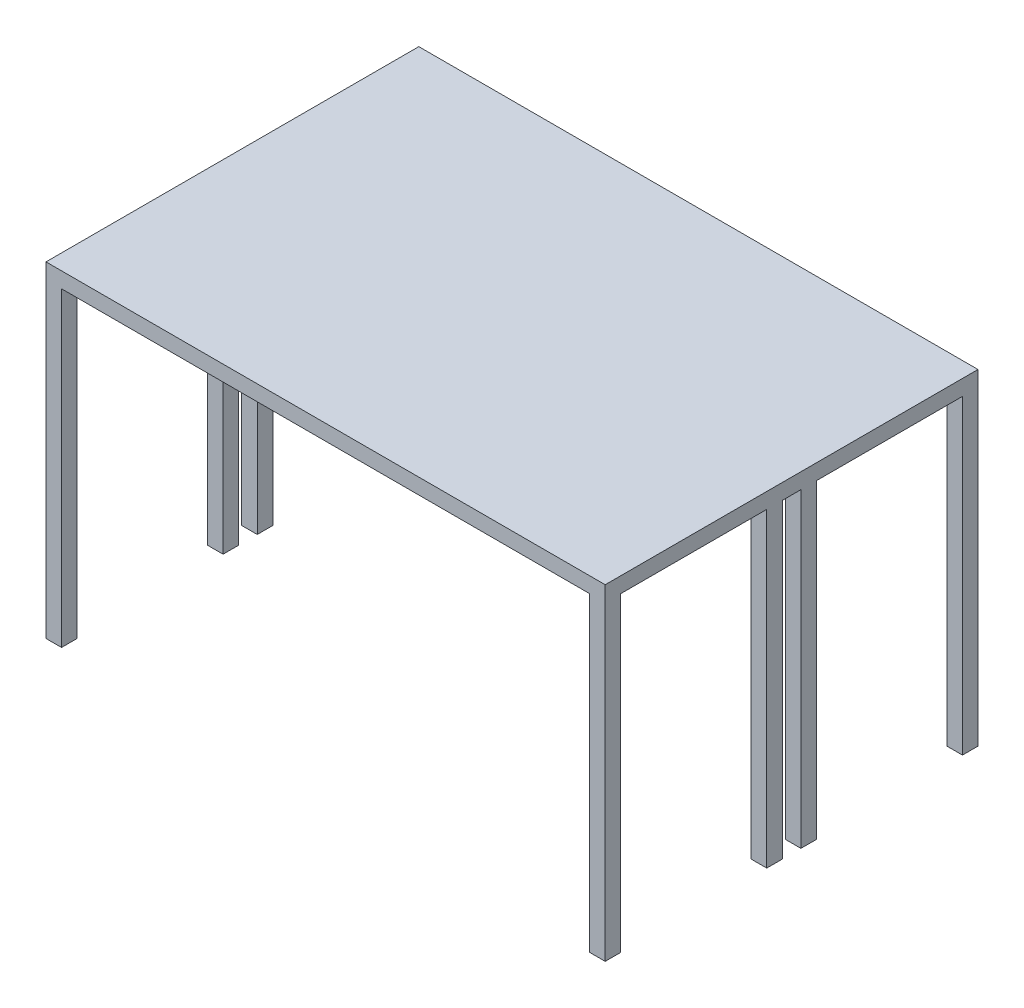
from build123d import *

# Parameters (mm, degrees)
SKETCH1_W           = 1800
SKETCH1_H           = 1200
BOSS_EXTRUDE1_DEPTH = 50
SKETCH2_W           = 50
SKETCH2_H           = 50
BOSS_EXTRUDE2_DEPTH = 1000


with BuildPart() as part:
    # Sketch1 → Boss-Extrude1 (new body)
    with BuildSketch(Plane(origin=(0, 0, 0), x_dir=(1, 0, 0), z_dir=(0, 1, 0))):
        Rectangle(SKETCH1_W, SKETCH1_H)
    extrude(amount=BOSS_EXTRUDE1_DEPTH)

    # Sketch2 → Boss-Extrude2 (add)
    with BuildSketch(Plane.XZ):
        with Locations((875, -575)):
            Rectangle(SKETCH2_W, SKETCH2_H)
        with Locations((-875, -575)):
            Rectangle(SKETCH2_W, SKETCH2_H)
        with Locations((-875, 575)):
            Rectangle(SKETCH2_W, SKETCH2_H)
        with Locations((875, 575)):
            Rectangle(SKETCH2_W, SKETCH2_H)
        with Locations((-875, 55)):
            Rectangle(SKETCH2_W, SKETCH2_H)
        with Locations((-875, -55)):
            Rectangle(SKETCH2_W, SKETCH2_H)
        with Locations((875, -55)):
            Rectangle(SKETCH2_W, SKETCH2_H)
        with Locations((875, 55)):
            Rectangle(SKETCH2_W, SKETCH2_H)
    extrude(amount=BOSS_EXTRUDE2_DEPTH)


solid = part.part
